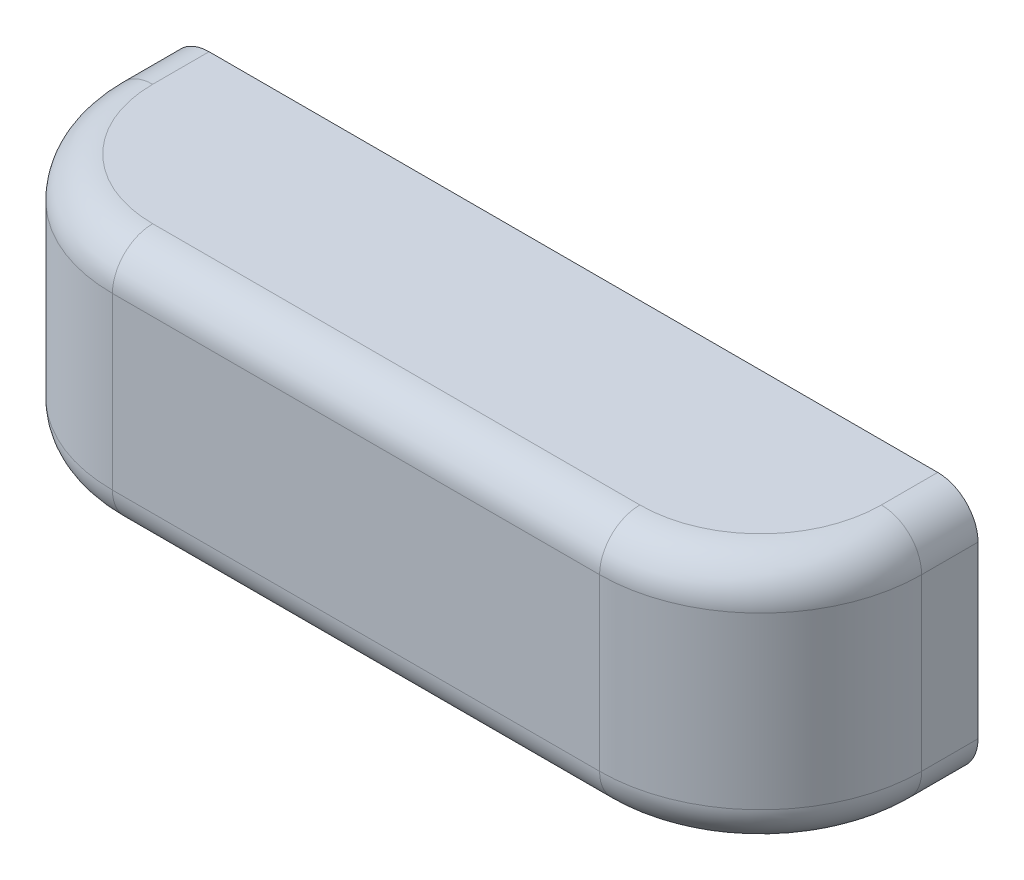
from build123d import *

# Parameters (mm, degrees)
SKETCH1_W           = 100.5
SKETCH1_H           = 31.15
BOSS_EXTRUDE1_DEPTH = 27
FILLET1_R           = 20
FILLET2_R           = 5


with BuildPart() as part:
    # Sketch1 → Boss-Extrude1 (new body)
    with BuildSketch(Plane.XY):
        Rectangle(SKETCH1_W, SKETCH1_H)
    extrude(amount=BOSS_EXTRUDE1_DEPTH)

    # Fillet1
    fillet1_edges = [part.edges().sort_by_distance(p)[0] for p in [
        (-50.25, 0, 27),
        (50.25, 0, 27),
    ]]
    fillet(fillet1_edges, radius=FILLET1_R)

    # Fillet2
    fillet2_edges = [part.edges().sort_by_distance(p)[0] for p in [
        (0, 15.575, 27),
        (0, -15.575, 27),
        (-50.25, 15.575, 3.5),
        (50.25, 15.575, 3.5),
        (-44.392135624, 15.575, 21.142135624),
        (44.392135624, 15.575, 21.142135624),
        (50.25, -15.575, 3.5),
        (-50.25, -15.575, 3.5),
        (-44.392135624, -15.575, 21.142135624),
        (44.392135624, -15.575, 21.142135624),
    ]]
    fillet(fillet2_edges, radius=FILLET2_R)


solid = part.part
